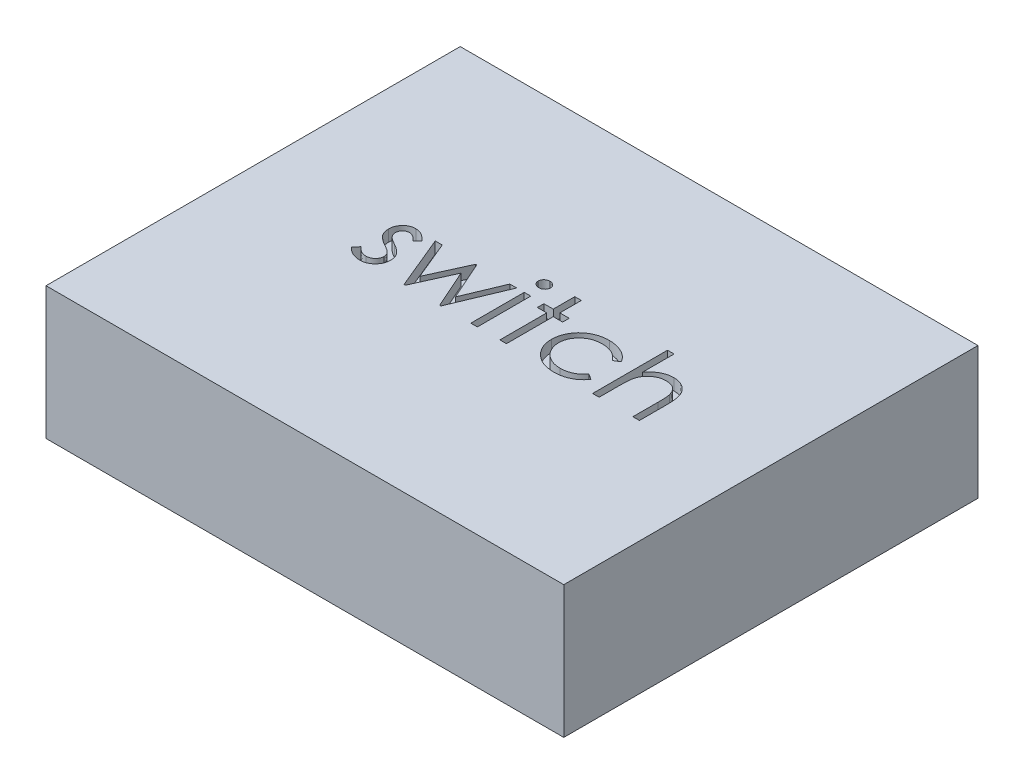
from build123d import *

# Parameters (mm, degrees)
SZKIC1_W                    = 90
SZKIC1_H                    = 72
DODANIE_WYCI_GNI_CIE1_DEPTH = 23
SZKIC2_W                    = 1.139743589
SZKIC2_H                    = 9.280769231
WYTNIJ_WYCI_GNI_CIE1_DEPTH  = 2


with BuildPart() as part:
    # Szkic1 → Dodanie-wyciągnięcie1 (new body)
    with BuildSketch(Plane(origin=(0, 0, 0), x_dir=(1, 0, 0), z_dir=(0, 1, 0))):
        Rectangle(SZKIC1_W, SZKIC1_H)
    extrude(amount=DODANIE_WYCI_GNI_CIE1_DEPTH)

    # Szkic2 → Wytnij-wyciągnięcie1 (cut)
    with BuildSketch(Plane(origin=(0, 23, 0), x_dir=(1, 0, 0), z_dir=(0, 1, 0))):
        with BuildLine():
            Line((-19.049503528, 3.409270199), (-19.822900964, 2.612976129))
            add(Edge.make_bspline(
                [(-19.822900964, 2.612976129), (-19.88963222, 2.690312403), (-20.018282225, 2.839407634), (-20.22232217, 3.038750704), (-20.425607817, 3.206161883), (-20.625356369, 3.347502936), (-20.82659066, 3.454361268), (-21.026949192, 3.53235691), (-21.226639414, 3.580623462), (-21.360120171, 3.586844426), (-21.425665387, 3.589899206)],
                knots=[0, 0, 0, 0, 1.26578478, 2.440284043, 3.530471711, 4.527705817, 5.468200915, 6.346673037, 7.188140097, 8, 8, 8, 8], degree=3))
            add(Edge.make_bspline(
                [(-21.425665387, 3.589899206), (-21.505999745, 3.585998952), (-21.664086391, 3.578323806), (-21.890602932, 3.501712216), (-22.100880914, 3.384114793), (-22.282879098, 3.217314504), (-22.43704868, 3.025855586), (-22.549584037, 2.811783207), (-22.618403463, 2.581557449), (-22.627129205, 2.421791965), (-22.63155481, 2.340760584)],
                knots=[0, 0, 0, 0, 0.99966794, 1.967205029, 2.953328237, 3.988086729, 5.028030931, 6.008226631, 6.989793394, 8, 8, 8, 8], degree=3))
            add(Edge.make_bspline(
                [(-22.63155481, 2.340760584), (-22.627524149, 2.267419738), (-22.619474188, 2.120944793), (-22.55689338, 1.904870499), (-22.457230775, 1.694206389), (-22.364084642, 1.565163843), (-22.316090067, 1.498673244)],
                knots=[0, 0, 0, 0, 0.960159726, 1.917612774, 2.927026955, 4, 4, 4, 4], degree=3))
            add(Edge.make_bspline(
                [(-22.316090067, 1.498673244), (-22.287193961, 1.463169181), (-22.225692241, 1.387603258), (-22.110272772, 1.282723561), (-21.979562548, 1.166818822), (-21.822373059, 1.050933727), (-21.645476473, 0.92889861), (-21.445036784, 0.805519442), (-21.227415009, 0.671391386), (-21.071613925, 0.586321577), (-20.990629329, 0.542102732)],
                knots=[0, 0, 0, 0, 0.66740084, 1.420478572, 2.27185888, 3.217733974, 4.268547843, 5.408967954, 6.65319498, 8, 8, 8, 8], degree=3))
            add(Edge.make_bspline(
                [(-20.990629329, 0.542102732), (-20.891882921, 0.486785513), (-20.701137375, 0.379930861), (-20.430109334, 0.214069937), (-20.184139214, 0.049218769), (-19.961142934, -0.112859625), (-19.765411228, -0.27670003), (-19.591005566, -0.436022463), (-19.442276069, -0.59564081), (-19.358986107, -0.707158108), (-19.319175003, -0.760461371)],
                knots=[0, 0, 0, 0, 1.27191281, 2.456916733, 3.569705269, 4.599008579, 5.553216877, 6.436649441, 7.252746552, 8, 8, 8, 8], degree=3))
            add(Edge.make_bspline(
                [(-19.319175003, -0.760461371), (-19.253096803, -0.868106891), (-19.121588922, -1.082341453), (-18.983491784, -1.435105461), (-18.903444501, -1.809249284), (-18.892333016, -2.065180483), (-18.886683015, -2.19531714)],
                knots=[0, 0, 0, 0, 0.995354457, 1.980940102, 2.973342416, 4, 4, 4, 4], degree=3))
            add(Edge.make_bspline(
                [(-18.886683015, -2.19531714), (-18.889293895, -2.287008042), (-18.894438919, -2.467694981), (-18.930209619, -2.733795649), (-18.991731962, -2.988283901), (-19.075529298, -3.233921077), (-19.188684022, -3.466000658), (-19.321300315, -3.690377904), (-19.480503566, -3.902199139), (-19.6622637, -4.101186223), (-19.861274493, -4.282925935), (-20.073568195, -4.442669996), (-20.299406237, -4.575382591), (-20.537174917, -4.685202558), (-20.787414461, -4.772535951), (-21.050163997, -4.832997136), (-21.324588335, -4.869184012), (-21.511205067, -4.874207682), (-21.606294394, -4.876767461)],
                knots=[0, 0, 0, 0, 1.032770009, 2.035186124, 3.017557409, 3.978232242, 4.952395191, 5.920591857, 6.910227898, 7.931268572, 8.952309245, 9.941945286, 10.918353717, 11.897095711, 12.887975737, 13.898235213, 14.929059601, 16, 16, 16, 16], degree=3))
            add(Edge.make_bspline(
                [(-21.606294394, -4.876767461), (-21.734626716, -4.873165377), (-21.989508194, -4.866011259), (-22.36647946, -4.798860695), (-22.734854785, -4.694374551), (-23.091846488, -4.550262447), (-23.429470958, -4.368287003), (-23.738374599, -4.150346318), (-24.019630477, -3.903639756), (-24.179716785, -3.714544337), (-24.259759938, -3.619996627)],
                knots=[0, 0, 0, 0, 1.013940152, 2.01379169, 3.017749504, 4.037548394, 5.051665909, 6.043208538, 7.021604269, 8, 8, 8, 8], degree=3))
            Line((-24.259759938, -3.619996627), (-23.504170996, -2.760100794))
            add(Edge.make_bspline(
                [(-23.504170996, -2.760100794), (-23.432425383, -2.837588083), (-23.293335665, -2.987808908), (-23.070899821, -3.187831515), (-22.844551708, -3.355476127), (-22.61655156, -3.495696518), (-22.383524361, -3.603738695), (-22.146775989, -3.679643308), (-21.906787993, -3.728426519), (-21.7455991, -3.73415343), (-21.664808015, -3.737023871)],
                knots=[0, 0, 0, 0, 1.179806542, 2.287233372, 3.337373186, 4.324005949, 5.273901747, 6.200048787, 7.097828587, 8, 8, 8, 8], degree=3))
            add(Edge.make_bspline(
                [(-21.664808015, -3.737023871), (-21.554797255, -3.732049735), (-21.339854685, -3.722331108), (-21.031993046, -3.634094803), (-20.747735744, -3.495737549), (-20.500908176, -3.299487358), (-20.290806049, -3.071048566), (-20.138666673, -2.813731619), (-20.043321694, -2.535088333), (-20.032123927, -2.341931121), (-20.026426605, -2.24365448)],
                knots=[0, 0, 0, 0, 1.072336372, 2.095165389, 3.102688358, 4.141489647, 5.156069229, 6.117746104, 7.042326257, 8, 8, 8, 8], degree=3))
            add(Edge.make_bspline(
                [(-20.026426605, -2.24365448), (-20.030368302, -2.162702435), (-20.038150654, -2.002873459), (-20.09926767, -1.771550793), (-20.195834305, -1.552133689), (-20.290919743, -1.423719826), (-20.339347278, -1.358317942)],
                knots=[0, 0, 0, 0, 1.013901739, 2.00181326, 2.98231254, 4, 4, 4, 4], degree=3))
            add(Edge.make_bspline(
                [(-20.339347278, -1.358317942), (-20.368457109, -1.325532485), (-20.431868835, -1.254113918), (-20.548183568, -1.150971489), (-20.687454896, -1.039798958), (-20.851249202, -0.922481478), (-21.039896678, -0.800566539), (-21.254161917, -0.674693747), (-21.491109637, -0.53888457), (-21.65864307, -0.448824678), (-21.746218272, -0.401747429)],
                knots=[0, 0, 0, 0, 0.615000592, 1.339693406, 2.178160186, 3.116406724, 4.166410947, 5.330106347, 6.604359322, 8, 8, 8, 8], degree=3))
            add(Edge.make_bspline(
                [(-21.746218272, -0.401747429), (-21.840730366, -0.348991151), (-22.024019478, -0.246679892), (-22.283633934, -0.087327258), (-22.517848619, 0.074751139), (-22.732299275, 0.230463441), (-22.92156921, 0.388019438), (-23.084912794, 0.547594036), (-23.228761034, 0.7027517), (-23.308398785, 0.812687605), (-23.346438624, 0.865199687)],
                knots=[0, 0, 0, 0, 1.262093308, 2.447601706, 3.550203992, 4.582594899, 5.537233252, 6.418365656, 7.244515135, 8, 8, 8, 8], degree=3))
            add(Edge.make_bspline(
                [(-23.346438624, 0.865199687), (-23.4122268, 0.970956633), (-23.543826142, 1.182507482), (-23.671606979, 1.535605498), (-23.759440284, 1.907334706), (-23.767286671, 2.163827006), (-23.7712984, 2.294967315)],
                knots=[0, 0, 0, 0, 0.985009483, 1.970363186, 2.962279964, 4, 4, 4, 4], degree=3))
            add(Edge.make_bspline(
                [(-23.7712984, 2.294967315), (-23.769360034, 2.380693759), (-23.765566377, 2.548472555), (-23.73528939, 2.794993417), (-23.680165181, 3.029211004), (-23.611023033, 3.254642764), (-23.51492756, 3.466921791), (-23.400098133, 3.6688789), (-23.265160905, 3.860234946), (-23.109700964, 4.038046311), (-22.938771137, 4.199551581), (-22.75409583, 4.340335173), (-22.559828442, 4.460463947), (-22.355146462, 4.561211815), (-22.138083603, 4.637416832), (-21.910157116, 4.689876486), (-21.671828354, 4.724911079), (-21.508901411, 4.728042842), (-21.425665387, 4.729642796)],
                knots=[0, 0, 0, 0, 1.087655834, 2.128696564, 3.144119009, 4.137814668, 5.115653402, 6.093965665, 7.082169637, 8.081268856, 9.086088321, 10.061021666, 11.022561449, 11.980240094, 12.950172527, 13.934149372, 14.944599409, 16, 16, 16, 16], degree=3))
            add(Edge.make_bspline(
                [(-21.425665387, 4.729642796), (-21.326997043, 4.725635617), (-21.127809438, 4.717546088), (-20.828979795, 4.653299725), (-20.530590239, 4.547588176), (-20.231874083, 4.401588129), (-19.935019605, 4.212659751), (-19.637415582, 3.984316293), (-19.335489301, 3.718060015), (-19.146962107, 3.514499968), (-19.049503528, 3.409270199)],
                knots=[0, 0, 0, 0, 0.845714091, 1.707292901, 2.609013841, 3.555613372, 4.552488639, 5.621697636, 6.770543573, 8, 8, 8, 8], degree=3))
        make_face()
        Polygon((-17.909759938, 4.566822283), (-16.688606092, 4.566822283), (-13.920657374, -2.108818743), (-10.895757535, 4.566822283), (-10.699864105, 4.566822283), (-7.733477887, -2.108818743), (-4.942632535, 4.566822283), (-3.744375323, 4.566822283), (-7.624082855, -4.713946948), (-7.858137342, -4.713946948), (-10.827067631, 1.961694078), (-13.85196747, -4.713946948), (-14.060581253, -4.713946948), align=None)
        with BuildLine():
            add(Edge.make_bspline(
                [(-1.877027567, 8.47451459), (-1.806301935, 8.471233809), (-1.667807565, 8.464809409), (-1.467534851, 8.409794906), (-1.285173693, 8.316541762), (-1.123420205, 8.191429777), (-0.984620502, 8.044293225), (-0.887444781, 7.872803425), (-0.824988372, 7.687533508), (-0.817446186, 7.558301613), (-0.813606092, 7.492503373)],
                knots=[0, 0, 0, 0, 1.055194115, 2.066272739, 3.074728998, 4.095836921, 5.109056067, 6.073838105, 7.019297344, 8, 8, 8, 8], degree=3))
            add(Edge.make_bspline(
                [(-0.813606092, 7.492503373), (-0.817532787, 7.428413174), (-0.825295396, 7.301714436), (-0.887396539, 7.119656409), (-0.98544866, 6.950549437), (-1.123331201, 6.803698575), (-1.285197277, 6.678655753), (-1.467528585, 6.585384272), (-1.667809213, 6.530374631), (-1.806302492, 6.52394956), (-1.877027567, 6.520668437)],
                knots=[0, 0, 0, 0, 0.96129708, 1.900370562, 2.859976407, 3.87933698, 4.906634145, 5.921202961, 6.938410037, 8, 8, 8, 8], degree=3))
            add(Edge.make_bspline(
                [(-1.877027567, 6.520668437), (-1.946943879, 6.523824279), (-2.083026847, 6.529966713), (-2.280300818, 6.586463634), (-2.461107051, 6.678687671), (-2.623176006, 6.802879828), (-2.758268421, 6.951451312), (-2.856596631, 7.119553207), (-2.918554349, 7.301740711), (-2.926336288, 7.428422), (-2.930272759, 7.492503373)],
                knots=[0, 0, 0, 0, 1.054934014, 2.053291228, 3.073705704, 4.106921865, 5.123545215, 6.088680038, 7.033164197, 8, 8, 8, 8], degree=3))
            add(Edge.make_bspline(
                [(-2.930272759, 7.492503373), (-2.92642253, 7.558292455), (-2.918860439, 7.687506365), (-2.856550189, 7.872908342), (-2.759087457, 8.043384077), (-2.623086556, 8.192248032), (-2.461130857, 8.316510038), (-2.280294667, 8.4087156), (-2.083028472, 8.465217317), (-1.946944431, 8.471359089), (-1.877027567, 8.47451459)],
                knots=[0, 0, 0, 0, 0.98631895, 1.937192651, 2.907499808, 3.917963147, 4.944918757, 5.95915025, 6.951458133, 8, 8, 8, 8], degree=3))
        make_face()
        with Locations((-1.871939425, -0.073562332)):
            Rectangle(SZKIC2_W, SZKIC2_H)
        Polygon((2.605624677, 8.311694078), (3.745368267, 8.311694078), (3.745368267, 4.566822283), (5.373573395, 4.566822283), (5.373573395, 3.427078693), (3.745368267, 3.427078693), (3.745368267, -4.713946948), (2.605624677, -4.713946948), (2.605624677, 3.427078693), (0.977419549, 3.427078693), (0.977419549, 4.566822283), (2.605624677, 4.566822283), align=None)
        with BuildLine():
            Line((16.445368267, 2.554462507), (15.491341824, 1.961694078))
            add(Edge.make_bspline(
                [(15.491341824, 1.961694078), (15.386730599, 2.091699964), (15.180821162, 2.347594478), (14.823264504, 2.677830522), (14.442223087, 2.961465216), (14.031185599, 3.192618827), (13.590728553, 3.371222375), (13.12258895, 3.497606264), (12.626833547, 3.576361659), (12.286962682, 3.585312753), (12.112816183, 3.589899206)],
                knots=[0, 0, 0, 0, 1.026593902, 2.0206758, 2.988051866, 3.946915611, 4.916868779, 5.907761954, 6.927957743, 8, 8, 8, 8], degree=3))
            add(Edge.make_bspline(
                [(12.112816183, 3.589899206), (11.973627968, 3.586064378), (11.699500563, 3.57851179), (11.297069664, 3.531302286), (10.913738839, 3.44551557), (10.54710541, 3.332482098), (10.199777034, 3.180988189), (9.870843702, 2.99662136), (9.557387781, 2.782354071), (9.268492748, 2.53412152), (9.004227494, 2.26416064), (8.775268577, 1.97476866), (8.575925991, 1.674613626), (8.419512949, 1.356200162), (8.291514473, 1.026812768), (8.207307232, 0.680233921), (8.15119248, 0.320903722), (8.144772344, 0.075908603), (8.141522113, -0.048121627)],
                knots=[0, 0, 0, 0, 1.112346261, 2.190735716, 3.231507886, 4.247384806, 5.251966152, 6.253067467, 7.256802811, 8.280671706, 9.291813951, 10.270744147, 11.225547591, 12.165006084, 13.100104208, 14.043489273, 15.009504848, 16, 16, 16, 16], degree=3))
            add(Edge.make_bspline(
                [(8.141522113, -0.048121627), (8.147978257, -0.210569907), (8.160803553, -0.533277618), (8.261320278, -1.009629587), (8.425855699, -1.470181264), (8.651037043, -1.91166279), (8.935796931, -2.320218725), (9.27025166, -2.686644402), (9.65458662, -3.003839704), (10.085415363, -3.266811438), (10.552622032, -3.478216972), (11.05115184, -3.628829294), (11.576931044, -3.719733618), (11.936909812, -3.731185182), (12.120448395, -3.737023871)],
                knots=[0, 0, 0, 0, 0.966302908, 1.919585723, 2.883856336, 3.870342332, 4.860282998, 5.839159637, 6.814385684, 7.815993281, 8.834850808, 9.858348828, 10.908058873, 12, 12, 12, 12], degree=3))
            add(Edge.make_bspline(
                [(12.120448395, -3.737023871), (12.288651492, -3.732308553), (12.619215215, -3.723041701), (13.102422221, -3.64492232), (13.562452183, -3.517038278), (13.999288751, -3.338702519), (14.412133696, -3.10818839), (14.79831956, -2.823856541), (15.165530764, -2.493886592), (15.381419793, -2.23873281), (15.491341824, -2.108818743)],
                knots=[0, 0, 0, 0, 1.039848629, 2.043578496, 3.018386758, 3.987534228, 4.954977003, 5.934852016, 6.948509513, 8, 8, 8, 8], degree=3))
            Line((15.491341824, -2.108818743), (16.445368267, -2.734660089))
            add(Edge.make_bspline(
                [(16.445368267, -2.734660089), (16.388807176, -2.817720727), (16.275872727, -2.983566313), (16.087086772, -3.217406394), (15.883451954, -3.436287927), (15.665762717, -3.639917514), (15.43686151, -3.833168041), (15.188928809, -4.006800897), (14.929959076, -4.170575825), (14.656912133, -4.317942533), (14.372611028, -4.450408328), (14.077455809, -4.564313433), (13.77272906, -4.662176389), (13.458072495, -4.739963333), (13.132865778, -4.802051232), (12.797949962, -4.843248949), (12.453440394, -4.874002112), (12.22058716, -4.875837687), (12.102639901, -4.876767461)],
                knots=[0, 0, 0, 0, 0.954134338, 1.905101784, 2.851144739, 3.791306361, 4.734911809, 5.6936923, 6.663572882, 7.643865596, 8.638447847, 9.640600242, 10.646758161, 11.676244097, 12.717260333, 13.78922464, 14.880174919, 16, 16, 16, 16], degree=3))
            add(Edge.make_bspline(
                [(12.102639901, -4.876767461), (11.922623266, -4.873533388), (11.569789355, -4.867194583), (11.05336197, -4.797495258), (10.559826663, -4.692420479), (10.08935205, -4.541603502), (9.641864886, -4.347457603), (9.217782428, -4.11030537), (8.818508877, -3.828177446), (8.447992608, -3.506095398), (8.107699932, -3.156879357), (7.815504898, -2.780052512), (7.562066345, -2.389469282), (7.358548688, -1.976503287), (7.196544127, -1.546643221), (7.085855163, -1.096445493), (7.0142644, -0.6296216), (7.005978995, -0.311276571), (7.001778523, -0.149884448)],
                knots=[0, 0, 0, 0, 1.1129367, 2.181364009, 3.217532258, 4.231199276, 5.232079859, 6.230262199, 7.231623845, 8.250719726, 9.263571943, 10.242672461, 11.195837495, 12.138959767, 13.085126421, 14.0317438, 15.002148558, 16, 16, 16, 16], degree=3))
            add(Edge.make_bspline(
                [(7.001778523, -0.149884448), (7.003378782, -0.040379843), (7.00656196, 0.177442891), (7.043072384, 0.500730705), (7.090238271, 0.819713141), (7.170160231, 1.130346865), (7.26247338, 1.437343203), (7.380313167, 1.737001885), (7.518545029, 2.030715412), (7.675487809, 2.317727174), (7.852158398, 2.593315503), (8.047670302, 2.853678801), (8.25465975, 3.101944807), (8.482810214, 3.329542453), (8.722439815, 3.545573775), (8.980328104, 3.744267541), (9.254995909, 3.926207708), (9.542318251, 4.094758535), (9.842127918, 4.2448342), (10.152612693, 4.374131949), (10.471901685, 4.484631296), (10.800505636, 4.572112231), (11.136243465, 4.645472596), (11.481760891, 4.69162021), (11.835736097, 4.724227543), (12.075425094, 4.727822703), (12.19677051, 4.729642796)],
                knots=[0, 0, 0, 0, 0.990994727, 1.971252077, 2.943264845, 3.907940874, 4.872158414, 5.844625996, 6.82015047, 7.809835459, 8.804511986, 9.781214284, 10.756496977, 11.728388426, 12.696359165, 13.676225489, 14.672885716, 15.677705647, 16.690706858, 17.706033469, 18.721040654, 19.747369689, 20.783475414, 21.830280724, 22.901553713, 24, 24, 24, 24], degree=3))
            add(Edge.make_bspline(
                [(12.19677051, 4.729642796), (12.348735474, 4.726297648), (12.651905809, 4.719624074), (13.101633516, 4.663458678), (13.544737219, 4.578780824), (13.973442423, 4.453330842), (14.382551204, 4.301425577), (14.765494123, 4.130836585), (15.113256786, 3.932736167), (15.432308324, 3.716037466), (15.723245429, 3.471613608), (15.989054588, 3.196542648), (16.235186573, 2.892256167), (16.374729497, 2.667989656), (16.445368267, 2.554462507)],
                knots=[0, 0, 0, 0, 1.095225653, 2.184976855, 3.262915854, 4.344593502, 5.400796181, 6.407717688, 7.363229445, 8.282371371, 9.184954523, 10.097238608, 11.036792983, 12, 12, 12, 12], degree=3))
        make_face()
        with BuildLine():
            Line((18.724855446, 8.311694078), (19.864599036, 8.311694078))
            Line((19.864599036, 8.311694078), (19.864599036, 2.813957699))
            add(Edge.make_bspline(
                [(19.864599036, 2.813957699), (19.986944673, 2.966880149), (20.225157899, 3.264627994), (20.62610095, 3.653107172), (21.037838115, 3.989833597), (21.474590425, 4.257877828), (21.92834517, 4.469628713), (22.401016108, 4.619806745), (22.892691061, 4.712157867), (23.226610891, 4.723763555), (23.395768908, 4.729642796)],
                knots=[0, 0, 0, 0, 1.125788106, 2.19196713, 3.20547328, 4.180437432, 5.132270164, 6.079753143, 7.027236121, 8, 8, 8, 8], degree=3))
            add(Edge.make_bspline(
                [(23.395768908, 4.729642796), (23.567510619, 4.723309377), (23.903650574, 4.71091335), (24.393077596, 4.612893367), (24.850135627, 4.445407806), (25.273465971, 4.216201744), (25.653829872, 3.930731771), (25.990741874, 3.601143103), (26.26593563, 3.219149171), (26.453166711, 2.866247907), (26.574990219, 2.552235857), (26.652103989, 2.282863369), (26.717487938, 1.982700998), (26.77445555, 1.651903255), (26.812423404, 1.288882205), (26.84292016, 0.895275625), (26.864606151, 0.471106082), (26.865446545, 0.177481177), (26.865881087, 0.025656417)],
                knots=[0, 0, 0, 0, 1.235656852, 2.418478516, 3.575258207, 4.727955599, 5.870717718, 6.98870536, 8.107142894, 9.245821548, 9.854588956, 10.528768408, 11.260415777, 12.065282286, 12.943670737, 13.886611085, 14.907229059, 16, 16, 16, 16], degree=3))
            Line((26.865881087, 0.025656417), (26.865881087, -4.713946948))
            Line((26.865881087, -4.713946948), (25.726137497, -4.713946948))
            Line((25.726137497, -4.713946948), (25.726137497, -0.348321948))
            add(Edge.make_bspline(
                [(25.726137497, -0.348321948), (25.725446969, -0.221965404), (25.724126105, 0.01973316), (25.719759683, 0.365775896), (25.710012559, 0.679633298), (25.694261563, 0.960299495), (25.677696019, 1.208165769), (25.654896553, 1.422872167), (25.628370847, 1.60471358), (25.604535555, 1.71416809), (25.593845831, 1.763256578)],
                knots=[0, 0, 0, 0, 1.430932559, 2.737130458, 3.918967929, 4.986496826, 5.920444988, 6.731744033, 7.431208747, 8, 8, 8, 8], degree=3))
            add(Edge.make_bspline(
                [(25.593845831, 1.763256578), (25.552392141, 1.907290049), (25.472697665, 2.184193558), (25.287466434, 2.560340017), (25.056112308, 2.881050362), (24.773637959, 3.141996493), (24.445040466, 3.346689793), (24.068177168, 3.488450032), (23.646594976, 3.576434623), (23.349591065, 3.58528581), (23.194787337, 3.589899206)],
                knots=[0, 0, 0, 0, 1.090059168, 2.095632401, 3.037101401, 3.955032261, 4.878929692, 5.839099886, 6.873700383, 8, 8, 8, 8], degree=3))
            add(Edge.make_bspline(
                [(23.194787337, 3.589899206), (23.103101417, 3.588172636), (22.921657351, 3.584755799), (22.652603621, 3.550451653), (22.391603876, 3.494394874), (22.136144545, 3.418541262), (21.891639799, 3.315324601), (21.650962734, 3.195835057), (21.420932319, 3.049573675), (21.197463783, 2.885468747), (20.989483019, 2.703787048), (20.795981772, 2.512028097), (20.623485509, 2.307830369), (20.46720805, 2.094469948), (20.332303985, 1.869020297), (20.214545659, 1.633655485), (20.114630418, 1.388065985), (20.064981791, 1.217613619), (20.040139901, 1.13232709)],
                knots=[0, 0, 0, 0, 1.024319606, 2.027102035, 3.025350316, 4.005802111, 5.00026367, 5.987881639, 7.005602596, 8.042517216, 9.083927026, 10.089214625, 11.084353441, 12.06828073, 13.041928858, 14.016821737, 15.00770877, 16, 16, 16, 16], degree=3))
            add(Edge.make_bspline(
                [(20.040139901, 1.13232709), (20.025845408, 1.070565354), (19.994695948, 0.935978929), (19.96089641, 0.714003525), (19.93064212, 0.456061547), (19.905065953, 0.162544226), (19.889379326, -0.167623996), (19.872476566, -0.532190048), (19.866184573, -0.933437552), (19.865143344, -1.212458393), (19.864599036, -1.358317942)],
                knots=[0, 0, 0, 0, 0.607992626, 1.324890765, 2.152360218, 3.099583803, 4.150613268, 5.323148443, 6.60066238, 8, 8, 8, 8], degree=3))
            Line((19.864599036, -1.358317942), (19.864599036, -4.713946948))
            Line((19.864599036, -4.713946948), (18.724855446, -4.713946948))
            Line((18.724855446, -4.713946948), (18.724855446, 8.311694078))
        make_face()
    extrude(amount=-WYTNIJ_WYCI_GNI_CIE1_DEPTH, mode=Mode.SUBTRACT)


solid = part.part
